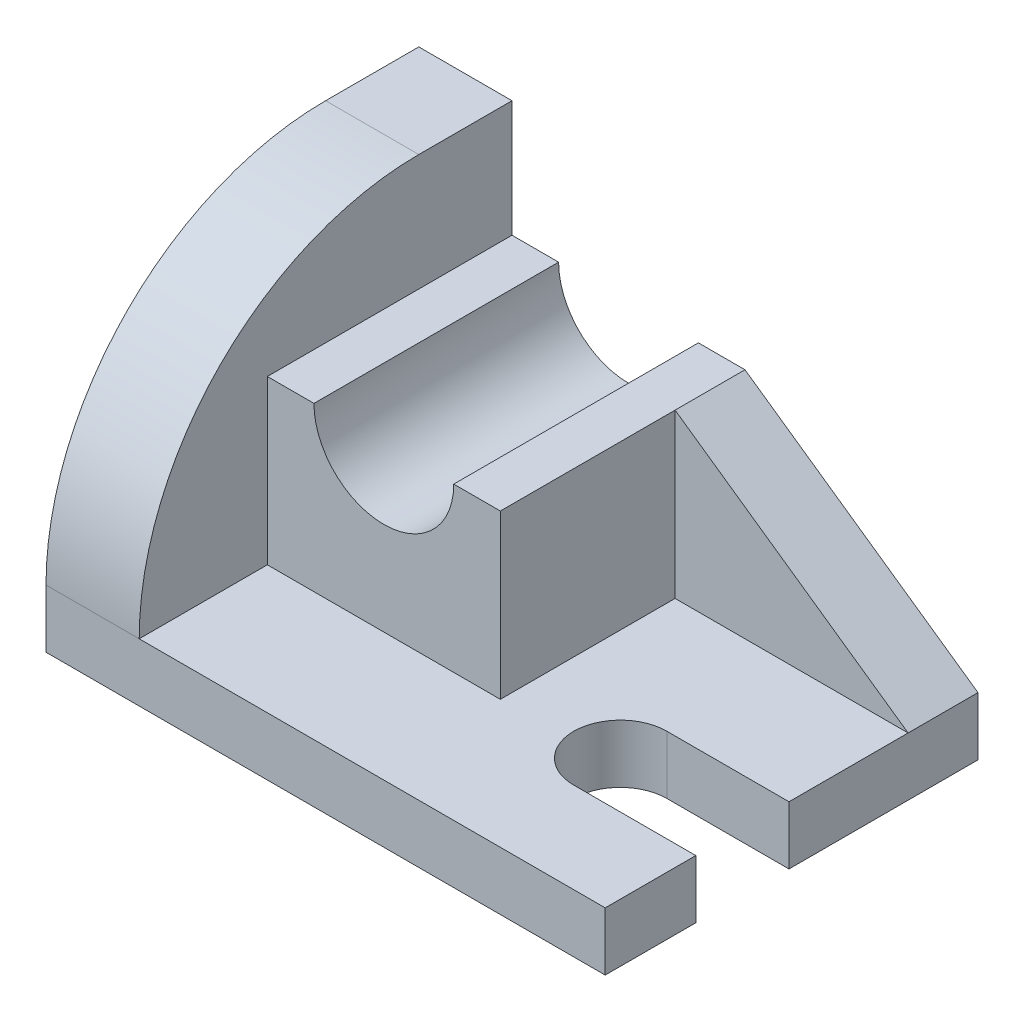
from build123d import *

# Parameters (mm, degrees)
SKETCH3_W                      = 96
SKETCH3_H                      = 64
BOSS_EXTRUDE1_DEPTH            = 10
CUT_EXTRUDE1_DEPTH             = 10
SKETCH5_W                      = 16
SKETCH5_H                      = 48
BOSS_EXTRUDE2_DEPTH            = 64
CUT_EXTRUDE5_REACH             = 131.136
CUT_EXTRUDE5_DIRECTION_2_DEPTH = 130.135587659
BOSS_EXTRUDE3_START            = -64
BOSS_EXTRUDE3_DEPTH            = 42
BOSS_EXTRUDE4_DEPTH            = 12


with BuildPart() as part:
    # Sketch3 → Boss-Extrude1 (new body)
    with BuildSketch(Plane(origin=(0, 0, 0), x_dir=(1, 0, 0), z_dir=(0, 1, 0))):
        with Locations((48, 32)):
            Rectangle(SKETCH3_W, SKETCH3_H)
    extrude(amount=BOSS_EXTRUDE1_DEPTH)

    # Sketch4 → Cut-Extrude1 (cut)
    with BuildSketch(Plane(origin=(0, 10, 0), x_dir=(1, 0, 0), z_dir=(0, 1, 0))):
        with BuildLine():
            Line((96, 15.550922522), (96, 31.550922522))
            Line((96, 31.550922522), (75.043299742, 31.550922522))
            ThreePointArc((75.043299742, 31.550922522), (67.043299742, 23.550922522), (75.043299742, 15.550922522))
            Line((75.043299742, 15.550922522), (96, 15.550922522))
        make_face()
    extrude(amount=-CUT_EXTRUDE1_DEPTH, mode=Mode.SUBTRACT)

    # Sketch5 → Boss-Extrude2 (add, through all)
    with BuildSketch(Plane.XY):
        with Locations((8, 34)):
            Rectangle(SKETCH5_W, SKETCH5_H)
    extrude(amount=-BOSS_EXTRUDE2_DEPTH)

    # Sketch6 → Cut-Extrude5 (cut, up to next)
    with BuildSketch(Plane(origin=(0, 0, 0), x_dir=(0, 0, -1), z_dir=(1, 0, 0)), mode=Mode.PRIVATE) as cut_extrude5_sk1:
        with BuildLine():
            Line((0, 58), (0, 10))
            ThreePointArc((0, 10), (14.058874503, 43.941125497), (48, 58))
            Line((48, 58), (0, 58))
        make_face()
    cut_extrude5_tool1 = extrude(cut_extrude5_sk1.sketch, amount=CUT_EXTRUDE5_REACH, mode=Mode.PRIVATE) & part.part
    add(cut_extrude5_tool1.solids().sort_by_distance((0, 47.278339, -10.721661))[0], mode=Mode.SUBTRACT)

    # Sketch6 → Cut-Extrude5 direction 2 (cut)
    with BuildSketch(Plane(origin=(0, 0, 0), x_dir=(0, 0, -1), z_dir=(1, 0, 0))):
        with BuildLine():
            Line((0, 58), (0, 10))
            ThreePointArc((0, 10), (14.058874503, 43.941125497), (48, 58))
            Line((48, 58), (0, 58))
        make_face()
    extrude(amount=-CUT_EXTRUDE5_DIRECTION_2_DEPTH, mode=Mode.SUBTRACT)

    # Sketch8 → Boss-Extrude3 (add)
    with BuildSketch(Plane.XY.offset(BOSS_EXTRUDE3_START)):
        with BuildLine():
            Line((16, 10), (16, 38))
            Line((16, 38), (24, 38))
            ThreePointArc((24, 38), (36, 26), (48, 38))
            Line((48, 38), (56, 38))
            Line((56, 38), (56, 10))
            Line((56, 10), (16, 10))
        make_face()
    extrude(amount=BOSS_EXTRUDE3_DEPTH)

    # Sketch10 → Boss-Extrude4 (add)
    with BuildSketch(Plane(origin=(0, 0, -64), x_dir=(-1, 0, 0), z_dir=(0, 0, -1))):
        Polygon((-56, 38), (-96, 10), (-56, 10), align=None)
    extrude(amount=-BOSS_EXTRUDE4_DEPTH)


solid = part.part
